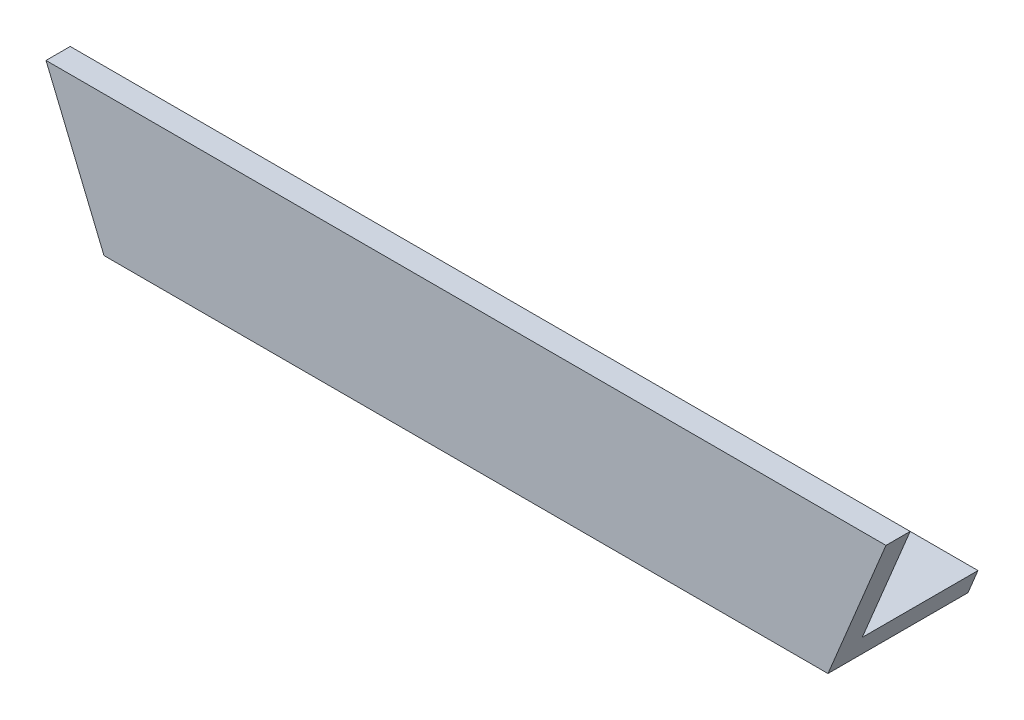
from build123d import *

# Parameters (mm, degrees)
BOSS_EXTRUDE1_DEPTH = 120
CUT_EXTRUDE1_DEPTH  = 124.288280059


with BuildPart() as part:
    # Sketch1 → Boss-Extrude1 (new body)
    with BuildSketch(Plane(origin=(0, 0, 0), x_dir=(0, 0, -1), z_dir=(1, 0, 0))):
        Polygon((0, 0), (20, 0), (20, 3.461178467), (3.461178467, 3.461178467), (3.461178467, 20), (0, 20), align=None)
    extrude(amount=BOSS_EXTRUDE1_DEPTH)

    # Sketch2 → Cut-Extrude1 (cut, through all)
    with BuildSketch(Plane(origin=(0, 0, 0), x_dir=(1, 0, 0), z_dir=(0, 0, -1))):
        Polygon((120, -20), (120, 0), (111.715728753, 0), align=None)
        Polygon((0, -20), (0, 0), (8.284271247, 0), align=None)
    extrude(amount=CUT_EXTRUDE1_DEPTH, mode=Mode.SUBTRACT)


solid = part.part
